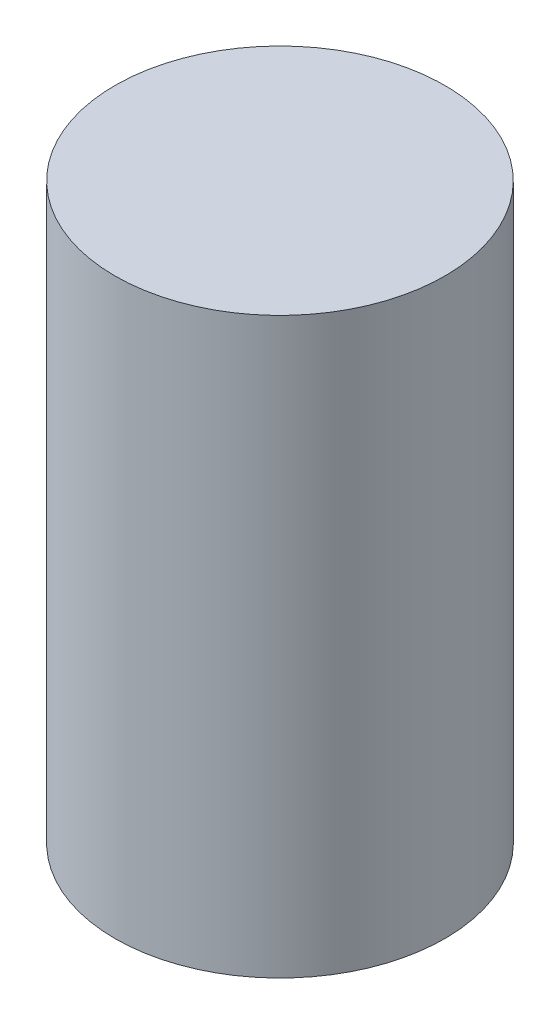
from build123d import *

# Parameters (mm, degrees)
SKETCH2_R           = 6.9
BOSS_EXTRUDE1_DEPTH = 24


with BuildPart() as part:
    # Sketch2 → Boss-Extrude1 (new body)
    with BuildSketch(Plane(origin=(0, 0, 0), x_dir=(1, 0, 0), z_dir=(0, 1, 0))):
        with Locations(Location((0, 0, 0), (0, 0, 270))):
            Circle(SKETCH2_R)
    extrude(amount=BOSS_EXTRUDE1_DEPTH)


solid = part.part
